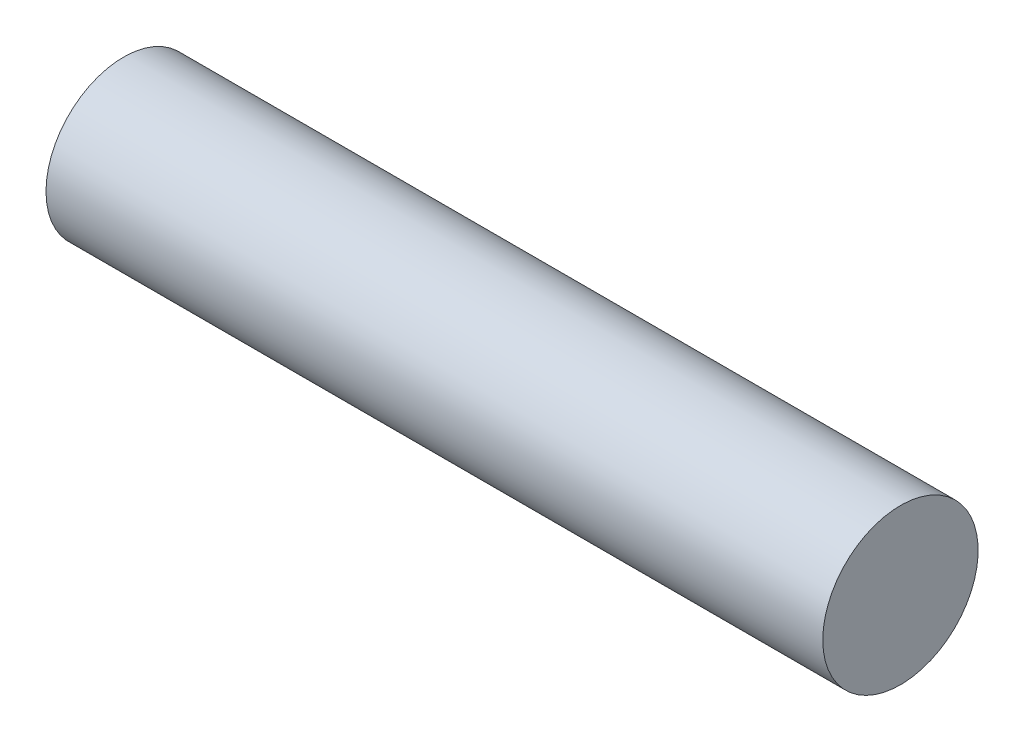
from build123d import *

# Parameters (mm, degrees)
SKETCH1_W = 200
SKETCH1_H = 20


with BuildPart() as part:
    # Sketch1 → Revolve1 (revolve)
    with BuildSketch(Plane(origin=(0, 0, 0), x_dir=(1, 0, 0), z_dir=(0, 1, 0)), mode=Mode.PRIVATE) as revolve1_sk:
        with Locations((0, 9.589186395)):
            Rectangle(SKETCH1_W, SKETCH1_H)
    revolve(revolve1_sk.sketch.rotate(Axis((-100, 0, 0.410813605), (1, 0, 0)), 180), axis=Axis((-100, 0, 0.410813605), (1, 0, 0)))


solid = part.part
